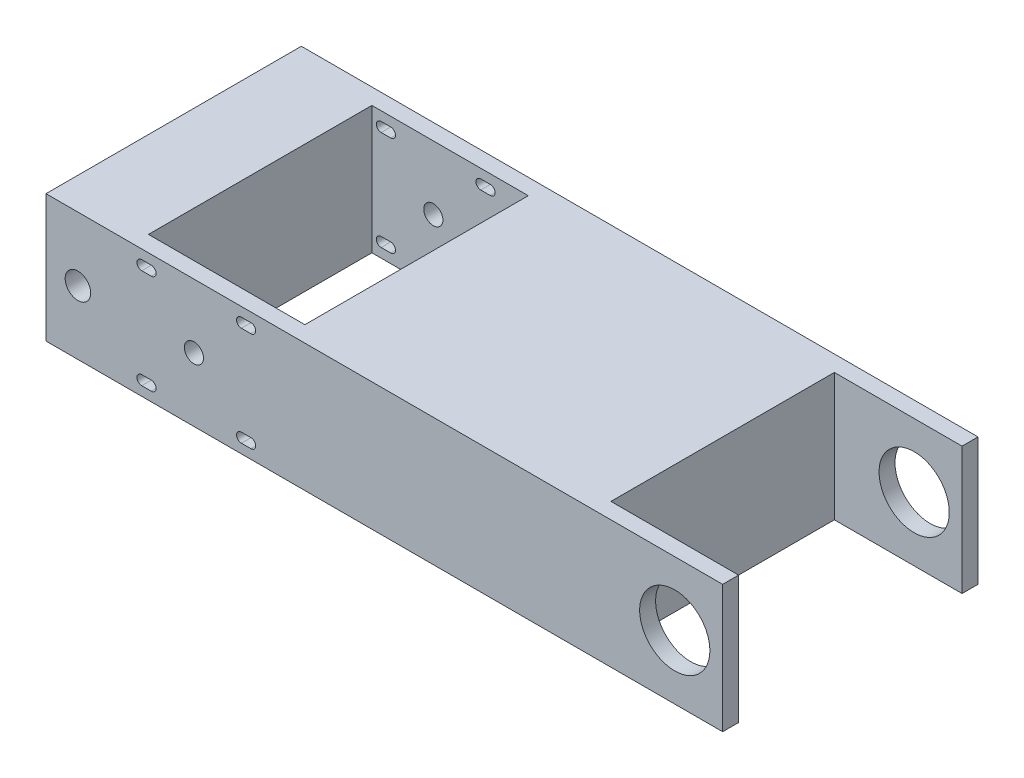
from build123d import *

# Parameters (mm, degrees)
SKETCH1_W               = 212
SKETCH1_H               = 40
SKETCH1_R               = 4
SKETCH1_R_2             = 3
SKETCH1_R_3             = 11
BOSS_EXTRUDE1_DEPTH     = 40
CUT_EXTRUDE3_DEPTH      = 116.047816146
CUT_EXTRUDE3_DEPTH_BACK = 116.047816146
SKETCH2_W               = 49
SKETCH2_H               = 70
SKETCH2_W_2             = 40


with BuildPart() as part:
    # Sketch1 → Boss-Extrude1 (new, symmetric)
    with BuildSketch(Plane.XY):
        Rectangle(SKETCH1_W, SKETCH1_H)
        with Locations((-96, 0)):
            Circle(SKETCH1_R, mode=Mode.SUBTRACT)
        with Locations((-59.65, 0)):
            Circle(SKETCH1_R_2, mode=Mode.SUBTRACT)
        with Locations((91, 0)):
            Circle(SKETCH1_R_3, mode=Mode.SUBTRACT)
        with BuildLine():
            Line((-76, 17.1), (-73, 17.1))
            ThreePointArc((-73, 17.1), (-71.5, 15.6), (-73, 14.1))
            Line((-73, 14.1), (-76, 14.1))
            ThreePointArc((-76, 14.1), (-77.5, 15.6), (-76, 17.1))
        make_face(mode=Mode.SUBTRACT)
        with BuildLine():
            Line((-44.8, 17.1), (-41.8, 17.1))
            ThreePointArc((-41.8, 17.1), (-40.3, 15.6), (-41.8, 14.1))
            Line((-41.8, 14.1), (-44.8, 14.1))
            ThreePointArc((-44.8, 14.1), (-46.3, 15.6), (-44.8, 17.1))
        make_face(mode=Mode.SUBTRACT)
        with BuildLine():
            Line((-76, -14.1), (-73, -14.1))
            ThreePointArc((-73, -14.1), (-71.5, -15.6), (-73, -17.1))
            Line((-73, -17.1), (-76, -17.1))
            ThreePointArc((-76, -17.1), (-77.5, -15.6), (-76, -14.1))
        make_face(mode=Mode.SUBTRACT)
        with BuildLine():
            Line((-44.8, -14.1), (-41.8, -14.1))
            ThreePointArc((-41.8, -14.1), (-40.3, -15.6), (-41.8, -17.1))
            Line((-41.8, -17.1), (-44.8, -17.1))
            ThreePointArc((-44.8, -17.1), (-46.3, -15.6), (-44.8, -14.1))
        make_face(mode=Mode.SUBTRACT)
    extrude(amount=BOSS_EXTRUDE1_DEPTH, both=True)

    # Sketch2 → Cut-Extrude3 (cut, two sides: drawn at the far end of the back side and taken through both)
    with BuildSketch(Plane(origin=(0, 0, 0), x_dir=(1, 0, 0), z_dir=(0, 1, 0)).offset(-CUT_EXTRUDE3_DEPTH_BACK)):
        with Locations((-54.4, 0)):
            Rectangle(SKETCH2_W, SKETCH2_H)
        with Locations((86, 0)):
            Rectangle(SKETCH2_W_2, SKETCH2_H)
    extrude(amount=CUT_EXTRUDE3_DEPTH + CUT_EXTRUDE3_DEPTH_BACK, mode=Mode.SUBTRACT)


solid = part.part
